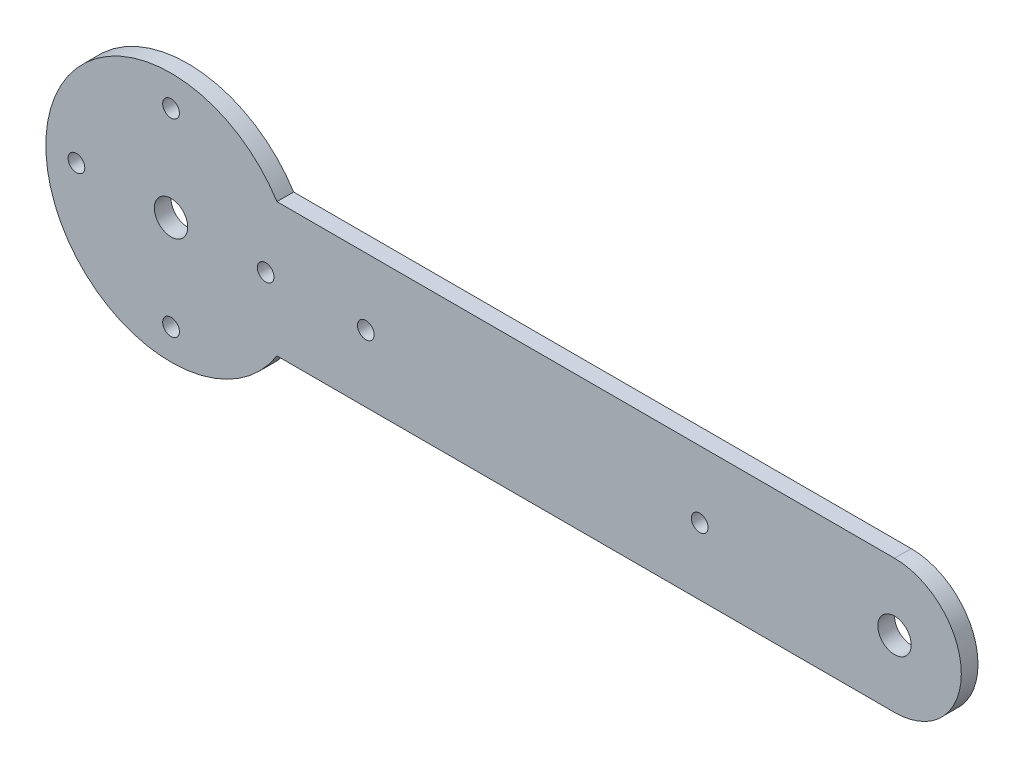
from build123d import *

# Parameters (mm, degrees)
BOSS_EXTRU_1_DEPTH      = 3
ESQUISSE2_R             = 3
ESQUISSE2_R_2           = 1.5
ENL_V_MAT_EXTRU_1_DEPTH = 78.987178433
ESQUISSE3_R             = 22.5
ESQUISSE3_R_2           = 3
BOSS_EXTRU_2_DEPTH      = 3
ESQUISSE4_R             = 1.5
ENL_V_MAT_EXTRU_2_DEPTH = 91.396349484


with BuildPart() as part:
    # Esquisse1 → Boss.-Extru.1 (new body)
    with BuildSketch(Plane.XY):
        with BuildLine():
            Line((-65, 12), (65, 12))
            ThreePointArc((65, 12), (77, 0), (65, -12))
            Line((65, -12), (-65, -12))
            ThreePointArc((-65, -12), (-77, 0), (-65, 12))
        make_face()
    extrude(amount=BOSS_EXTRU_1_DEPTH)

    # Esquisse2 → Enlèv. mat.-Extru.1 (cut, through all)
    with BuildSketch(Plane.XY.offset(3)):
        with Locations((-65, 0)):
            Circle(ESQUISSE2_R)
        with Locations(Location((65, 0, 0), (0, 0, 180))):
            Circle(ESQUISSE2_R)
        with Locations((-30, 0)):
            Circle(ESQUISSE2_R_2)
        with Locations(Location((30, 0, 0), (0, 0, 180))):
            Circle(ESQUISSE2_R_2)
    extrude(amount=-ENL_V_MAT_EXTRU_1_DEPTH, mode=Mode.SUBTRACT)

    # Esquisse3 → Boss.-Extru.2 (add)
    with BuildSketch(Plane.XY.offset(3)):
        with Locations((-65, 0)):
            Circle(ESQUISSE3_R)
        with Locations((-65, 0)):
            Circle(ESQUISSE3_R_2, mode=Mode.SUBTRACT)
    extrude(amount=-BOSS_EXTRU_2_DEPTH)

    # Esquisse4 → Enlèv. mat.-Extru.2 (cut, through all)
    with BuildSketch(Plane(origin=(0, 0, 0), x_dir=(-1, 0, 0), z_dir=(0, 0, -1))):
        with Locations((65, 17)):
            Circle(ESQUISSE4_R)
        with Locations((82, 0)):
            Circle(ESQUISSE4_R)
        with Locations((65, -17)):
            Circle(ESQUISSE4_R)
        with Locations((48, 0)):
            Circle(ESQUISSE4_R)
    extrude(amount=-ENL_V_MAT_EXTRU_2_DEPTH, mode=Mode.SUBTRACT)


solid = part.part
